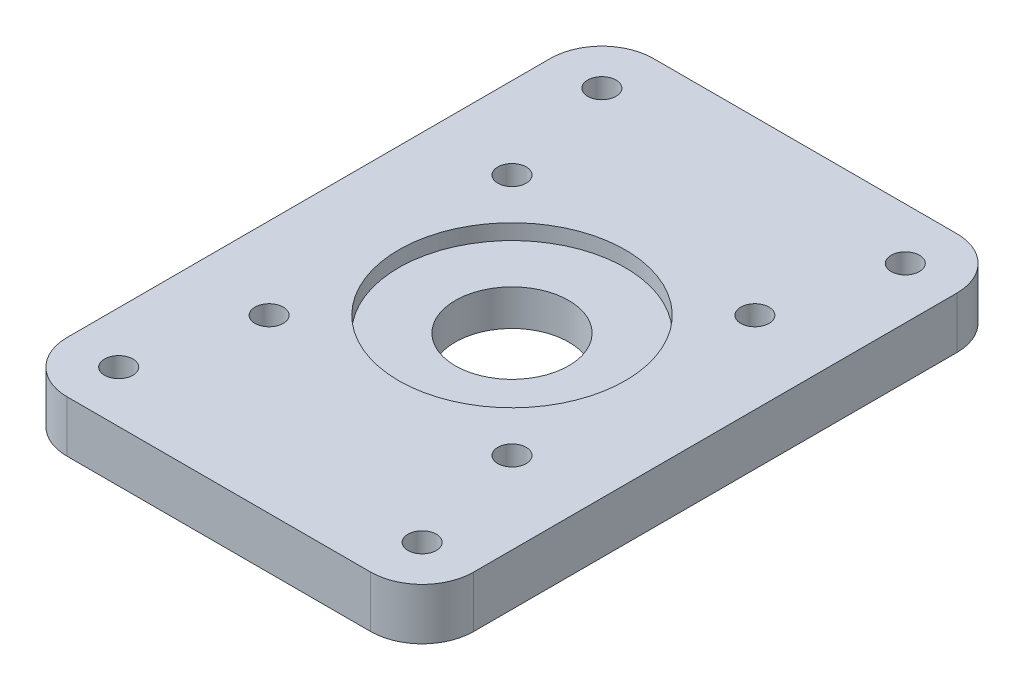
from build123d import *

# Parameters (mm, degrees)
SKETCH1_W           = 78.9
SKETCH1_H           = 113.78
SKETCH1_R           = 2.75
BOSS_EXTRUDE1_DEPTH = 10
SKETCH2_R           = 11
CUT_EXTRUDE1_DEPTH  = 10
SKETCH3_R           = 22
CUT_EXTRUDE2_DEPTH  = 3
FILLET1_R           = 10


with BuildPart() as part:
    # Sketch1 → Boss-Extrude1 (new body)
    with BuildSketch(Plane(origin=(0, 0, 0), x_dir=(1, 0, 0), z_dir=(0, 1, 0))):
        with Locations((29.45, 46.89)):
            Rectangle(SKETCH1_W, SKETCH1_H)
        with Locations(Location((0, 93.78, 0), (0, 0, 270))):
            Circle(SKETCH1_R, mode=Mode.SUBTRACT)
        with Locations(Location((58.9, 93.78, 0), (0, 0, 270))):
            Circle(SKETCH1_R, mode=Mode.SUBTRACT)
        with Locations(Location((58.9, 0, 0), (0, 0, 270))):
            Circle(SKETCH1_R, mode=Mode.SUBTRACT)
        with Locations(Location((0, 0, 0), (0, 0, 270))):
            Circle(SKETCH1_R, mode=Mode.SUBTRACT)
        with Locations(Location((5.88, 70.46, 0), (0, 0, 270))):
            Circle(SKETCH1_R, mode=Mode.SUBTRACT)
        with Locations(Location((53.02, 70.46, 0), (0, 0, 270))):
            Circle(SKETCH1_R, mode=Mode.SUBTRACT)
        with Locations(Location((53.02, 23.32, 0), (0, 0, 270))):
            Circle(SKETCH1_R, mode=Mode.SUBTRACT)
        with Locations(Location((5.88, 23.32, 0), (0, 0, 270))):
            Circle(SKETCH1_R, mode=Mode.SUBTRACT)
    extrude(amount=BOSS_EXTRUDE1_DEPTH)

    # Sketch2 → Cut-Extrude1 (cut)
    with BuildSketch(Plane(origin=(0, 10, 0), x_dir=(1, 0, 0), z_dir=(0, 1, 0))):
        with Locations(Location((29.45, 46.89, 0), (0, 0, 270))):
            Circle(SKETCH2_R)
    extrude(amount=-CUT_EXTRUDE1_DEPTH, mode=Mode.SUBTRACT)

    # Sketch3 → Cut-Extrude2 (cut)
    with BuildSketch(Plane(origin=(0, 10, 0), x_dir=(1, 0, 0), z_dir=(0, 1, 0))):
        with Locations(Location((29.45, 46.89, 0), (0, 0, 270))):
            Circle(SKETCH3_R)
    extrude(amount=-CUT_EXTRUDE2_DEPTH, mode=Mode.SUBTRACT)

    # Fillet1
    fillet1_edges = [part.edges().sort_by_distance(p)[0] for p in [
        (-10, 5, 10),
        (-10, 5, -103.78),
        (68.9, 5, -103.78),
        (68.9, 5, 10),
    ]]
    fillet(fillet1_edges, radius=FILLET1_R)


solid = part.part
